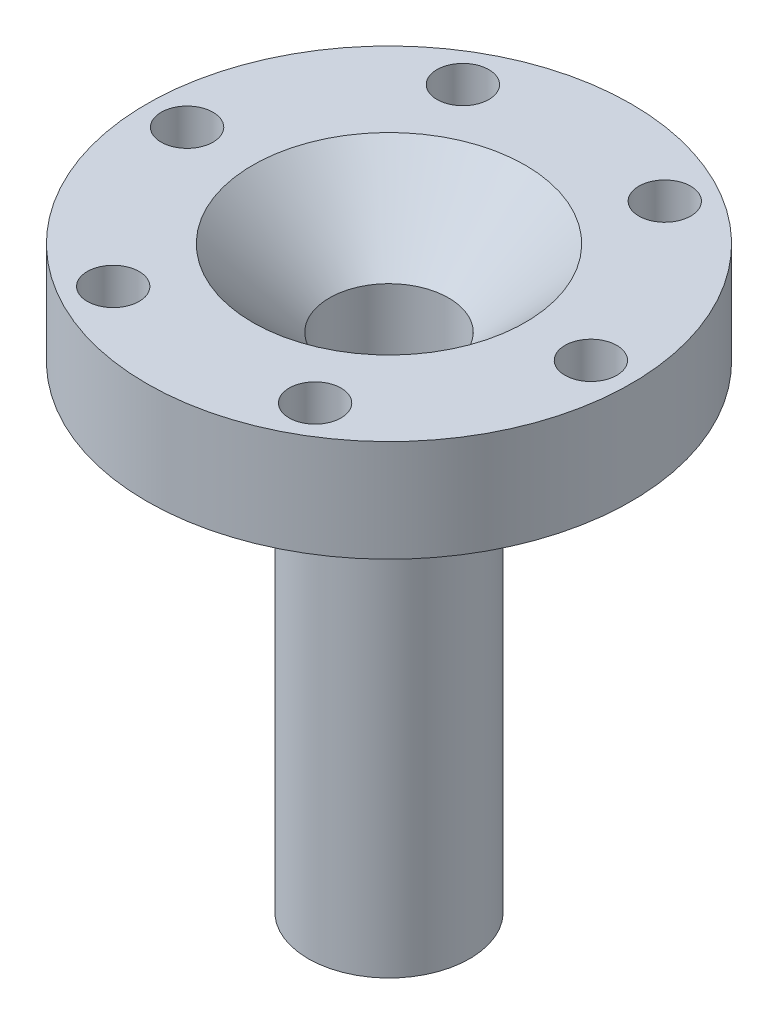
from build123d import *

# Parameters (mm, degrees)
F_1_4_CLEARANCE_HOLE1_D = 6.5278
CIRPATTERN1_COUNT       = 6


with BuildPart() as part:
    # Sketch1 → Revolve1 (revolve)
    with BuildSketch(Plane.XY, mode=Mode.PRIVATE) as revolve1_sk:
        Polygon((7.5, -72.82), (7.5, -9.645), (17.145, 0), (30.48, 0), (30.48, -12.82), (10.16, -12.82), (10.16, -72.82), align=None)
    revolve(revolve1_sk.sketch.rotate(Axis((0, 0, 0), (0, -1, 0)), 90), axis=Axis((0, 0, 0), (0, -1, 0)))

    # 1/4 Clearance Hole1 (through all)
    with Locations(Plane(origin=(0, 0, 0), x_dir=(1, 0, 0), z_dir=(0, 1, 0))):
        with Locations((25.4, 0)):
            f_1_4_clearance_hole1 = Hole(F_1_4_CLEARANCE_HOLE1_D / 2)

    # CirPattern1: 1/4 Clearance Hole1 ×6 about axis
    cirpattern1_axis = Axis((0, 0, 0), (0, 1, 0))
    for i in range(1, CIRPATTERN1_COUNT):
        add(f_1_4_clearance_hole1.rotate(cirpattern1_axis, i * 360 / CIRPATTERN1_COUNT), mode=Mode.SUBTRACT)


solid = part.part
